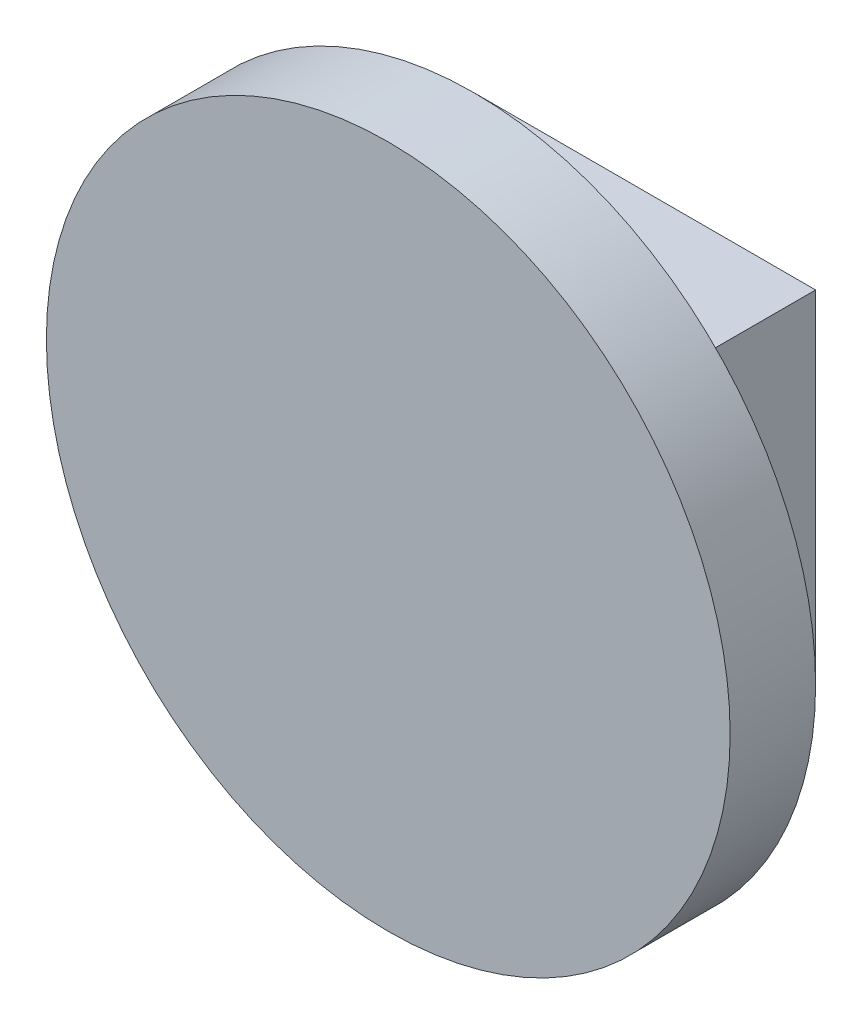
from build123d import *

# Parameters (mm, degrees)
SKETCH2_R           = 6.35
BOSS_EXTRUDE1_DEPTH = 1.5875
SKETCH3_W           = 6.35
SKETCH3_H           = 6.35
SKETCH3_W_2         = 3.175
SKETCH3_H_2         = 3.175
BOSS_EXTRUDE2_DEPTH = 3.175


with BuildPart() as part:
    # Sketch2 → Boss-Extrude1 (new body)
    with BuildSketch(Plane.XY):
        Circle(SKETCH2_R)
    extrude(amount=BOSS_EXTRUDE1_DEPTH)

    # Sketch3 → Boss-Extrude2 (add)
    with BuildSketch(Plane(origin=(0, 0, 0), x_dir=(-1, 0, 0), z_dir=(0, 0, -1))):
        Rectangle(SKETCH3_W, SKETCH3_H)
        Rectangle(SKETCH3_W_2, SKETCH3_H_2, mode=Mode.SUBTRACT)
    extrude(amount=BOSS_EXTRUDE2_DEPTH)


solid = part.part
